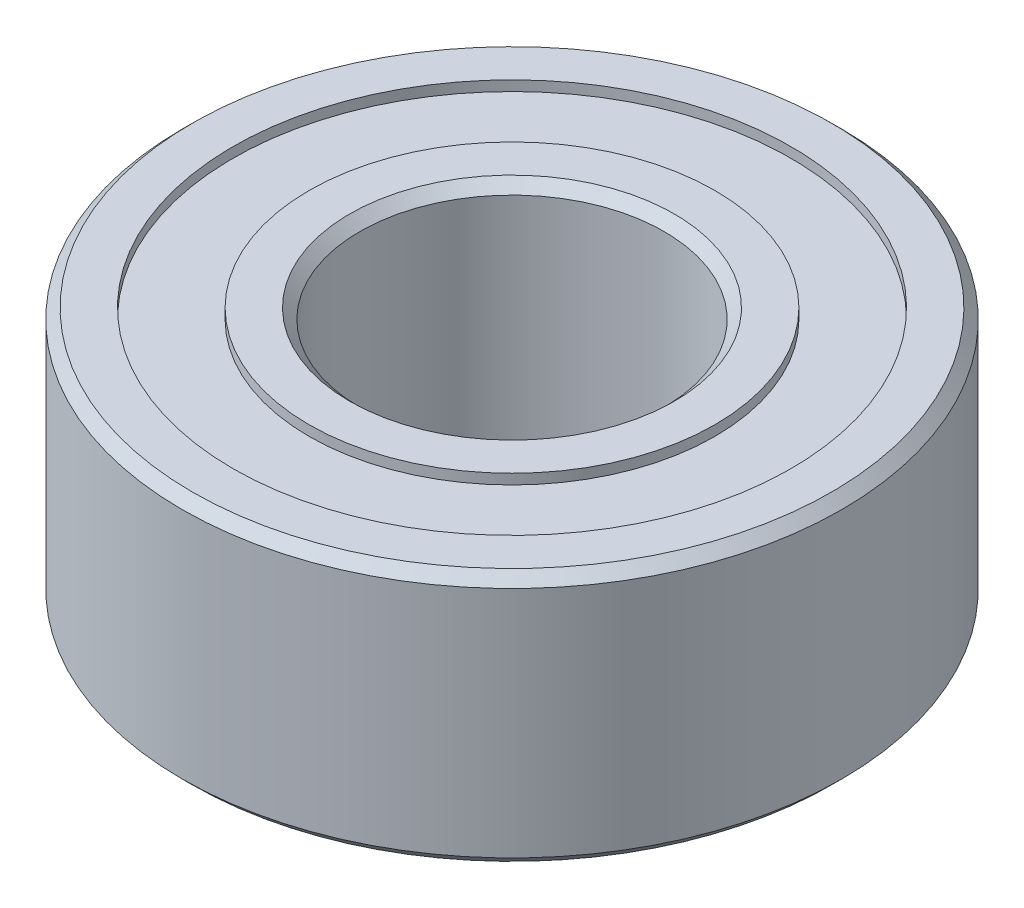
from build123d import *

# Parameters (mm, degrees)
SKETCH1_R           = 6.5
SKETCH1_R_2         = 3
BOSS_EXTRUDE1_DEPTH = 5
SKETCH2_R           = 5.5
SKETCH2_R_2         = 4
CUT_EXTRUDE1_DEPTH  = 0.2
CUT_EXTRUDE2_START  = -0.2
SKETCH3_R           = 5.5
SKETCH3_R_2         = 4
CUT_EXTRUDE2_DEPTH  = 0.2
CHAMFER1_SIZE       = 0.2


with BuildPart() as part:
    # Sketch1 → Boss-Extrude1 (new body)
    with BuildSketch(Plane(origin=(0, 0, 0), x_dir=(1, 0, 0), z_dir=(0, 1, 0))):
        with Locations(Location((0, 0, 0), (0, 0, 270))):
            Circle(SKETCH1_R)
        with Locations(Location((0, 0, 0), (0, 0, 270))):
            Circle(SKETCH1_R_2, mode=Mode.SUBTRACT)
    extrude(amount=BOSS_EXTRUDE1_DEPTH)

    # Sketch2 → Cut-Extrude1 (cut)
    with BuildSketch(Plane(origin=(0, 5, 0), x_dir=(1, 0, 0), z_dir=(0, 1, 0))):
        with Locations(Location((0, 0, 0), (0, 0, 270))):
            Circle(SKETCH2_R)
        with Locations(Location((0, 0, 0), (0, 0, 270))):
            Circle(SKETCH2_R_2, mode=Mode.SUBTRACT)
    extrude(amount=-CUT_EXTRUDE1_DEPTH, mode=Mode.SUBTRACT)

    # Sketch3 → Cut-Extrude2 (cut)
    with BuildSketch(Plane.XZ.offset(CUT_EXTRUDE2_START)):
        with Locations(Location((0, 0, 0), (0, 0, 90))):
            Circle(SKETCH3_R)
        with Locations(Location((0, 0, 0), (0, 0, 90))):
            Circle(SKETCH3_R_2, mode=Mode.SUBTRACT)
    extrude(amount=CUT_EXTRUDE2_DEPTH, mode=Mode.SUBTRACT)

    # Chamfer1
    chamfer1_edges = [part.edges().sort_by_distance(p)[0] for p in [
        (0, 0, -6.5),
        (0, 5, -6.5),
        (0, 0, -3),
        (0, 5, -3),
    ]]
    chamfer(chamfer1_edges, length=CHAMFER1_SIZE)


solid = part.part
